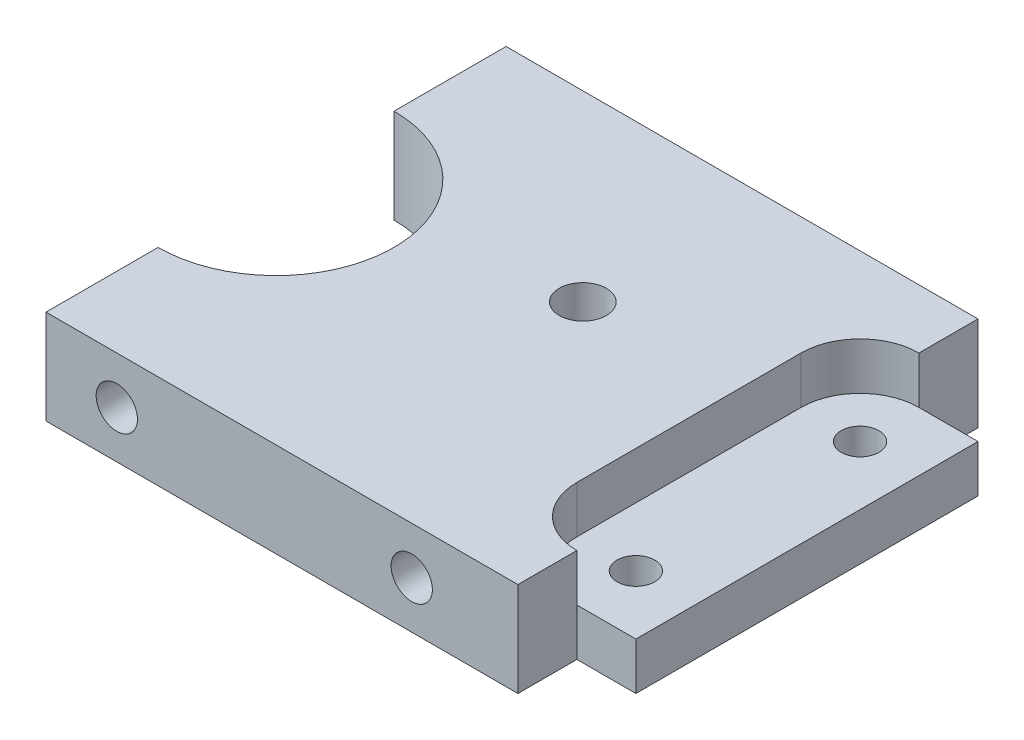
from build123d import *

# Parameters (mm, degrees)
SKETCH_1_W          = 40
SKETCH_1_H          = 39
SKETCH_1_R          = 2
EXTRUDE_1_DEPTH     = 8
SKETCH_2_R          = 1.75
CUT_EXTRUDE_1_DEPTH = 8
CUT_EXTRUDE_START   = -31
SKETCH_2_3_R        = 1.75
CUT_EXTRUDE_2_DEPTH = 8
SKETCH_4_R          = 10
CUT_EXTRUDE_3_DEPTH = 10
CUT_EXTRUDE_5_DEPTH = 10
EXTRUDE_START       = -4
SKETCH_7_R          = 1.6
EXTRUDE_2_DEPTH     = 4


with BuildPart() as part:
    # 草图1 → 凸台-拉伸1 (new body)
    with BuildSketch(Plane(origin=(0, 0, 0), x_dir=(1, 0, 0), z_dir=(0, 1, 0))):
        with Locations((-2, -4)):
            Rectangle(SKETCH_1_W, SKETCH_1_H)
        with Locations(Location((0, 0, 0), (0, 0, 270))):
            Circle(SKETCH_1_R, mode=Mode.SUBTRACT)
    extrude(amount=EXTRUDE_1_DEPTH)

    # 草图2 → 切除-拉伸1 (cut)
    with BuildSketch(Plane.XY.offset(23.5)):
        with Locations((9, 4)):
            Circle(SKETCH_2_R)
        with Locations((-16, 4)):
            Circle(SKETCH_2_R)
    extrude(amount=-CUT_EXTRUDE_1_DEPTH, mode=Mode.SUBTRACT)

    # 草图2<3> → 切除-拉伸2 (cut)
    with BuildSketch(Plane.XY.offset(23.5).offset(CUT_EXTRUDE_START)):
        with Locations((9, 4)):
            Circle(SKETCH_2_3_R)
        with Locations((-16, 4)):
            Circle(SKETCH_2_3_R)
    extrude(amount=-CUT_EXTRUDE_2_DEPTH, mode=Mode.SUBTRACT)

    # 草图4 → 切除-拉伸3 (cut)
    with BuildSketch(Plane(origin=(0, 0, 0), x_dir=(-1, 0, 0), z_dir=(0, -1, 0))):
        with Locations((22, -4)):
            Circle(SKETCH_4_R)
    extrude(amount=-CUT_EXTRUDE_3_DEPTH, mode=Mode.SUBTRACT)

    # 草图6 → 切除-拉伸5 (cut)
    with BuildSketch(Plane(origin=(0, 8, 0), x_dir=(1, 0, 0), z_dir=(0, 1, 0))):
        with BuildLine():
            Line((13, -13.5), (13, 5.5))
            ThreePointArc((13, 5.5), (18, 10.5), (23, 5.5))
            Line((23, 5.5), (23, -13.5))
            ThreePointArc((23, -13.5), (18, -18.5), (13, -13.5))
        make_face()
    extrude(amount=-CUT_EXTRUDE_5_DEPTH, mode=Mode.SUBTRACT)

    # 草图7 → 凸台-拉伸2 (add)
    with BuildSketch(Plane.XZ.offset(EXTRUDE_START)):
        with BuildLine():
            Line((13, -5.5), (13, 13.5))
            ThreePointArc((13, 13.5), (14.464466094, 17.035533906), (18, 18.5))
            Line((18, 18.5), (23, 18.5))
            Line((23, 18.5), (23, -10.5))
            Line((23, -10.5), (18, -10.5))
            ThreePointArc((18, -10.5), (14.464466094, -9.035533906), (13, -5.5))
        make_face()
        with Locations(Location((18, 13.5, 0), (0, 0, 270))):
            Circle(SKETCH_7_R, mode=Mode.SUBTRACT)
        with Locations(Location((18, -5.5, 0), (0, 0, 270))):
            Circle(SKETCH_7_R, mode=Mode.SUBTRACT)
    extrude(amount=EXTRUDE_2_DEPTH)


solid = part.part
